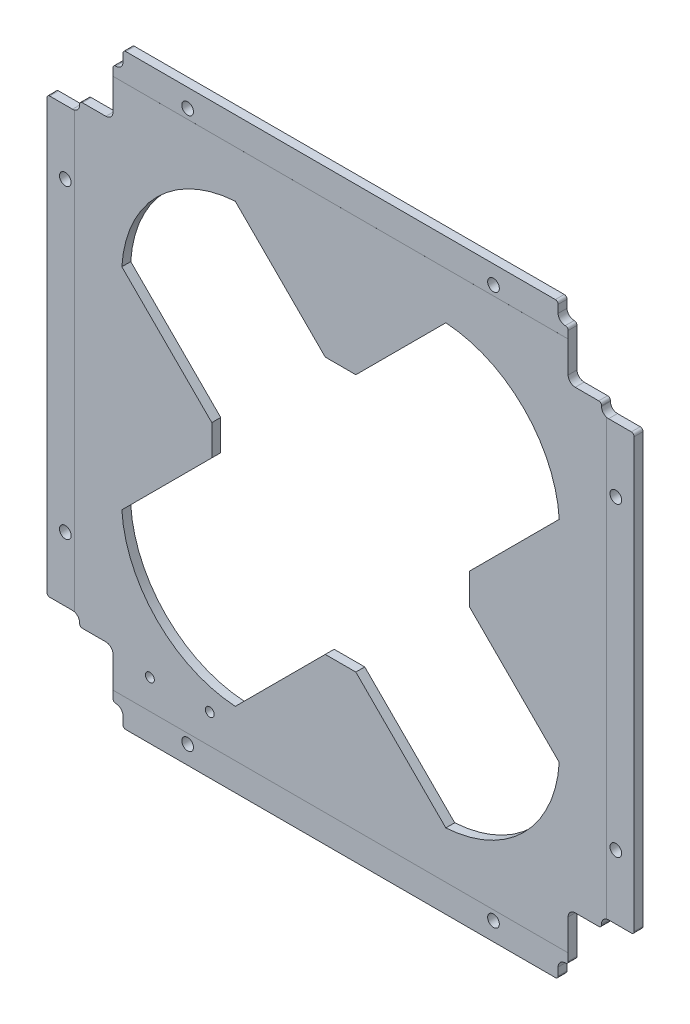
from build123d import *

# Parameters (mm, degrees)
SKETCH1_W                    = 106
SKETCH1_H                    = 106
MAINOUTLINE_DEPTH            = 1.6
SKETCH4_W                    = 11.7
SKETCH4_H                    = 11.7
RAILCUTOUTS_DEPTH            = 75.970394157
SKETCH13_W                   = 5.7
SKETCH13_H                   = 1.9
SKETCH13_W_2                 = 1.8
SKETCH13_H_2                 = 3
FILLETCUTOUTS_DEPTH          = 75.970394157
SMOOTHCORNER_DEPTH           = 10
MIRROR2_COPY_1_SKETCH_W      = 11.7
MIRROR2_COPY_1_SKETCH_H      = 11.7
MIRROR2_COPY_1_DEPTH         = 75.970394157
MIRROR2_COPY_2_SKETCH_W      = 5.7
MIRROR2_COPY_2_SKETCH_H      = 1.9
MIRROR2_COPY_2_SKETCH_W_2    = 1.8
MIRROR2_COPY_2_SKETCH_H_2    = 3
MIRROR2_COPY_2_DEPTH         = 75.970394157
MIRROR2_COPY_3_DEPTH         = 10
MIRROR2_COPY_4_SKETCH_W      = 11.7
MIRROR2_COPY_4_SKETCH_H      = 11.7
MIRROR2_COPY_4_DEPTH         = 75.970394157
MIRROR2_COPY_5_SKETCH_W      = 5.7
MIRROR2_COPY_5_SKETCH_H      = 1.9
MIRROR2_COPY_5_SKETCH_W_2    = 1.8
MIRROR2_COPY_5_SKETCH_H_2    = 3
MIRROR2_COPY_5_DEPTH         = 75.970394157
FILLET10_R                   = 0.5
M2_CLEARANCE_HOLE1_D         = 2.1
SKETCH16_W                   = 90
SKETCH16_H                   = 5.2
SKETCH16_W_2                 = 5.2
SKETCH16_H_2                 = 90
CUT_EXTRUDE6_DEPTH           = 0.001
CUT_EXTRUDE8_DEPTH           = 10
SKETCH29_R                   = 0.8
CONNECTOR_LOCATION_DEPTH     = 10
CUT_EXTRUDE_THIN1_DEPTH      = 75.970394157
CUT_EXTRUDE_THIN1_DEPTH_BACK = 75.970394157
SKETCH31_W                   = 125.6
SKETCH31_H                   = 125.6
SKETCH31_W_2                 = 105.6
SKETCH31_H_2                 = 105.6
FILLET12_R                   = 0.5


with BuildPart() as part:
    # Sketch1 → mainOutline (new body)
    with BuildSketch(Plane.XY):
        Rectangle(SKETCH1_W, SKETCH1_H)
    extrude(amount=MAINOUTLINE_DEPTH)

    # Sketch4 → railCutouts (cut, through all)
    with BuildSketch(Plane(origin=(0, 0, 0), x_dir=(-1, 0, 0), z_dir=(0, 0, -1))):
        with Locations((47.15, 47.15)):
            Rectangle(SKETCH4_W, SKETCH4_H)
    railcutouts = extrude(amount=-RAILCUTOUTS_DEPTH, mode=Mode.SUBTRACT)

    # Sketch13 → filletCutouts (cut, symmetric)
    with BuildSketch(Plane(origin=(0, 0, 0), x_dir=(-1, 0, 0), z_dir=(0, 0, -1))):
        with Locations((50.15, 40.35)):
            Rectangle(SKETCH13_W, SKETCH13_H)
        with Locations((40.4, 51.5)):
            Rectangle(SKETCH13_W_2, SKETCH13_H_2)
    filletcutouts = extrude(amount=FILLETCUTOUTS_DEPTH, both=True, mode=Mode.SUBTRACT)

    # Sketch27 → smoothCorner (cut)
    with BuildSketch(Plane.XY.offset(1.6)):
        with BuildLine():
            Line((-40.928025612, 42.198025612), (-40.928025612, 49.628025612))
            Line((-40.928025612, 49.628025612), (-40.398025612, 49.628025612))
            ThreePointArc((-40.398025612, 49.628025612), (-39.5, 50), (-39.128025612, 50.898025612))
            Line((-39.128025612, 50.898025612), (-39.128025612, 53))
            Line((-39.128025612, 53), (-53, 53))
            Line((-53, 53), (-53, 39.028025612))
            Line((-53, 39.028025612), (-48.198025612, 39.028025612))
            ThreePointArc((-48.198025612, 39.028025612), (-47.3, 39.4), (-46.928025612, 40.298025612))
            Line((-46.928025612, 40.298025612), (-46.928025612, 40.928025612))
            Line((-46.928025612, 40.928025612), (-42.198025612, 40.928025612))
            ThreePointArc((-42.198025612, 40.928025612), (-41.3, 41.3), (-40.928025612, 42.198025612))
        make_face()
    smoothcorner = extrude(amount=-SMOOTHCORNER_DEPTH, mode=Mode.SUBTRACT)

    # Mirror1: railCutouts, filletCutouts, smoothCorner across plane
    add(railcutouts.mirror(Plane(origin=(0, 0, 0), x_dir=(0, 0, 1), z_dir=(1, 0, 0))), mode=Mode.SUBTRACT)
    add(filletcutouts.mirror(Plane(origin=(0, 0, 0), x_dir=(0, 0, 1), z_dir=(1, 0, 0))), mode=Mode.SUBTRACT)
    add(smoothcorner.mirror(Plane(origin=(0, 0, 0), x_dir=(0, 0, 1), z_dir=(1, 0, 0))), mode=Mode.SUBTRACT)

    # Mirror2: smoothCorner across plane
    add(smoothcorner.mirror(Plane.ZX), mode=Mode.SUBTRACT)

    # Mirror2 copy 1 sketch → Mirror2 copy 1 (cut, through all)
    with BuildSketch(Plane(origin=(0, 0, 0), x_dir=(1, 0, 0), z_dir=(0, 0, -1))):
        with Locations((47.15, 47.15)):
            Rectangle(MIRROR2_COPY_1_SKETCH_W, MIRROR2_COPY_1_SKETCH_H)
    extrude(amount=-MIRROR2_COPY_1_DEPTH, mode=Mode.SUBTRACT)

    # Mirror2 copy 2 sketch → Mirror2 copy 2 (cut, symmetric)
    with BuildSketch(Plane(origin=(0, 0, 0), x_dir=(1, 0, 0), z_dir=(0, 0, -1))):
        with Locations((50.15, 40.35)):
            Rectangle(MIRROR2_COPY_2_SKETCH_W, MIRROR2_COPY_2_SKETCH_H)
        with Locations((40.4, 51.5)):
            Rectangle(MIRROR2_COPY_2_SKETCH_W_2, MIRROR2_COPY_2_SKETCH_H_2)
    extrude(amount=MIRROR2_COPY_2_DEPTH, both=True, mode=Mode.SUBTRACT)

    # Mirror2 copy 3 sketch → Mirror2 copy 3 (cut)
    with BuildSketch(Plane(origin=(0, 0, 1.6), x_dir=(-1, 0, 0), z_dir=(0, 0, 1))):
        with BuildLine():
            Line((-40.928025612, 42.198025612), (-40.928025612, 49.628025612))
            Line((-40.928025612, 49.628025612), (-40.398025612, 49.628025612))
            ThreePointArc((-40.398025612, 49.628025612), (-39.5, 50), (-39.128025612, 50.898025612))
            Line((-39.128025612, 50.898025612), (-39.128025612, 53))
            Line((-39.128025612, 53), (-53, 53))
            Line((-53, 53), (-53, 39.028025612))
            Line((-53, 39.028025612), (-48.198025612, 39.028025612))
            ThreePointArc((-48.198025612, 39.028025612), (-47.3, 39.4), (-46.928025612, 40.298025612))
            Line((-46.928025612, 40.298025612), (-46.928025612, 40.928025612))
            Line((-46.928025612, 40.928025612), (-42.198025612, 40.928025612))
            ThreePointArc((-42.198025612, 40.928025612), (-41.3, 41.3), (-40.928025612, 42.198025612))
        make_face()
    extrude(amount=-MIRROR2_COPY_3_DEPTH, mode=Mode.SUBTRACT)

    # Mirror2 copy 4 sketch → Mirror2 copy 4 (cut, through all)
    with BuildSketch(Plane(origin=(0, 0, 0), x_dir=(-1, 0, 0), z_dir=(0, 0, -1))):
        with Locations((47.15, -47.15)):
            Rectangle(MIRROR2_COPY_4_SKETCH_W, MIRROR2_COPY_4_SKETCH_H)
    extrude(amount=-MIRROR2_COPY_4_DEPTH, mode=Mode.SUBTRACT)

    # Mirror2 copy 5 sketch → Mirror2 copy 5 (cut, symmetric)
    with BuildSketch(Plane(origin=(0, 0, 0), x_dir=(-1, 0, 0), z_dir=(0, 0, -1))):
        with Locations((50.15, -40.35)):
            Rectangle(MIRROR2_COPY_5_SKETCH_W, MIRROR2_COPY_5_SKETCH_H)
        with Locations((40.4, -51.5)):
            Rectangle(MIRROR2_COPY_5_SKETCH_W_2, MIRROR2_COPY_5_SKETCH_H_2)
    extrude(amount=MIRROR2_COPY_5_DEPTH, both=True, mode=Mode.SUBTRACT)

    # Fillet10
    fillet10_edges = [part.edges().sort_by_distance(p)[0] for p in [
        (40.928025612, 49.628025612, 0.8),
        (46.928025612, 40.928025612, 0.8),
        (46.928025612, -40.928025612, 0.8),
        (40.928025612, -49.628025612, 0.8),
        (-40.928025612, -49.628025612, 0.8),
        (-46.928025612, -40.928025612, 0.8),
        (-46.928025612, 40.928025612, 0.8),
        (-40.928025612, 49.628025612, 0.8),
    ]]
    fillet(fillet10_edges, radius=FILLET10_R)

    # M2 Clearance Hole1 (through all)
    with Locations(Plane(origin=(0, 0, 0), x_dir=(-1, 0, 0), z_dir=(0, 0, -1))):
        with Locations((49.5, -27.5), (27.5, -49.5), (-49.5, -27.5), (-27.5, -49.5), (-27.5, 49.5), (-49.5, 27.5), (27.5, 49.5), (49.5, 27.5)):
            Hole(M2_CLEARANCE_HOLE1_D / 2)

    # Sketch16 → Cut-Extrude6 (cut)
    with BuildSketch(Plane.XY.offset(1.6)):
        with Locations((0, -50.4)):
            Rectangle(SKETCH16_W, SKETCH16_H)
        with Locations((0, 50.4)):
            Rectangle(SKETCH16_W, SKETCH16_H)
        with Locations((-50.4, 0)):
            Rectangle(SKETCH16_W_2, SKETCH16_H_2)
        with Locations((50.4, 0)):
            Rectangle(SKETCH16_W_2, SKETCH16_H_2)
    extrude(amount=-CUT_EXTRUDE6_DEPTH, mode=Mode.SUBTRACT)

    # Sketch30 → Cut-Extrude8 (cut)
    with BuildSketch(Plane(origin=(0, 0, 0), x_dir=(-1, 0, 0), z_dir=(0, 0, -1))):
        with BuildLine():
            Line((-18.930017367, -39.330048004), (-2.75, -23.150030637))
            Line((-2.75, -23.150030637), (2.75, -23.150030637))
            Line((2.75, -23.150030637), (18.930017367, -39.330048004))
            ThreePointArc((18.930017367, -39.330048004), (32.985735805, -32.985735805), (39.330048004, -18.930017367))
            Line((39.330048004, -18.930017367), (23.150030637, -2.75))
            Line((23.150030637, -2.75), (23.150030637, 2.75))
            Line((23.150030637, 2.75), (39.330048004, 18.930017367))
            ThreePointArc((39.330048004, 18.930017367), (32.985735805, 32.985735805), (18.930017367, 39.330048004))
            Line((18.930017367, 39.330048004), (2.75, 23.150030637))
            Line((2.75, 23.150030637), (-2.75, 23.150030637))
            Line((-2.75, 23.150030637), (-18.930017367, 39.330048004))
            ThreePointArc((-18.930017367, 39.330048004), (-32.985735805, 32.985735805), (-39.330048004, 18.930017367))
            Line((-39.330048004, 18.930017367), (-23.150030637, 2.75))
            Line((-23.150030637, 2.75), (-23.150030637, -2.75))
            Line((-23.150030637, -2.75), (-39.330048004, -18.930017367))
            ThreePointArc((-39.330048004, -18.930017367), (-32.985735805, -32.985735805), (-18.930017367, -39.330048004))
        make_face()
    extrude(amount=-CUT_EXTRUDE8_DEPTH, mode=Mode.SUBTRACT)

    # Sketch29 → Connector Location (cut)
    with BuildSketch(Plane(origin=(0, 0, 0), x_dir=(-1, 0, 0), z_dir=(0, 0, -1))):
        with Locations((34.285, -42.5)):
            Circle(SKETCH29_R)
        with Locations((23.515, -42.5)):
            Circle(SKETCH29_R)
    extrude(amount=-CONNECTOR_LOCATION_DEPTH, mode=Mode.SUBTRACT)

    # Sketch31 → Cut-Extrude-Thin1 (cut, two sides: drawn at the far end of the back side and taken through both)
    with BuildSketch(Plane(origin=(0, 0, 0), x_dir=(-1, 0, 0), z_dir=(0, 0, -1)).offset(-CUT_EXTRUDE_THIN1_DEPTH_BACK)):
        Rectangle(SKETCH31_W, SKETCH31_H)
        Rectangle(SKETCH31_W_2, SKETCH31_H_2, mode=Mode.SUBTRACT)
    extrude(amount=CUT_EXTRUDE_THIN1_DEPTH + CUT_EXTRUDE_THIN1_DEPTH_BACK, mode=Mode.SUBTRACT)

    # Fillet12
    fillet12_edges = [part.edges().sort_by_distance(p)[0] for p in [
        (-52.8, 39.028025612, 0.7995),
        (39.128025612, -52.8, 0.7995),
        (52.8, -39.028025612, 0.7995),
        (-39.128025612, 52.8, 0.7995),
        (-52.8, -39.028025612, 0.7995),
        (-39.128025612, -52.8, 0.7995),
        (52.8, 39.028025612, 0.7995),
        (39.128025612, 52.8, 0.7995),
    ]]
    fillet(fillet12_edges, radius=FILLET12_R)


solid = part.part
